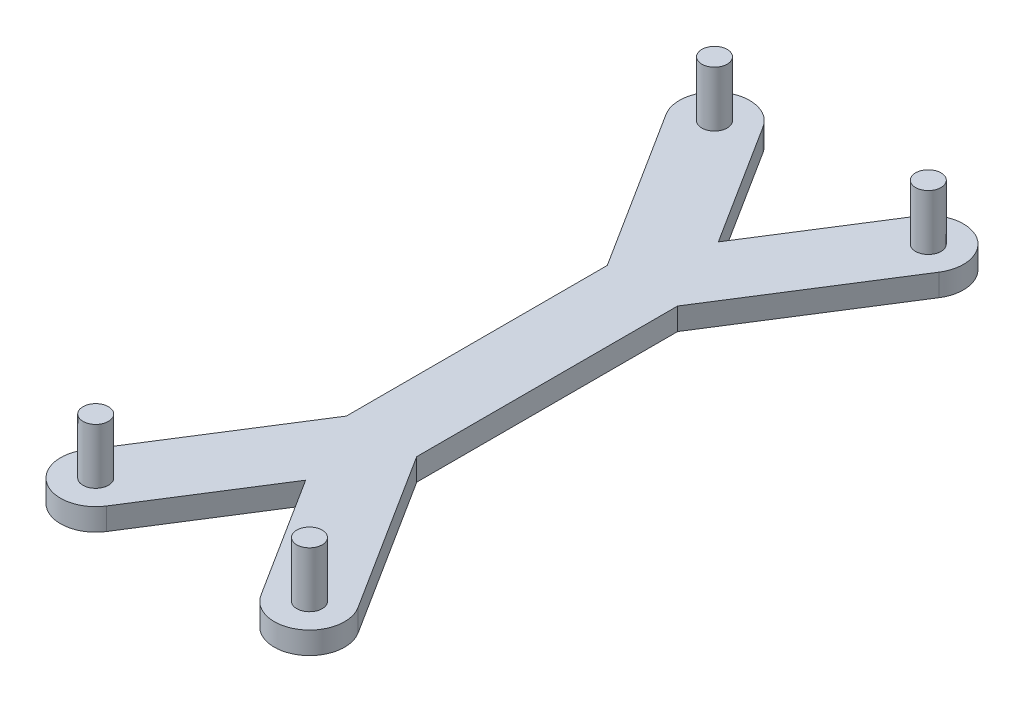
from build123d import *

# Parameters (mm, degrees)
SKETCH1_R             = 1.15
BOSS_EXTRUDE1_DEPTH   = 5
BOSS_EXTRUDE1_2_DEPTH = 5
BOSS_EXTRUDE1_3_DEPTH = 5
BOSS_EXTRUDE1_4_DEPTH = 5
BOSS_EXTRUDE2_START   = -2
SKETCH1_3_R           = 1.15
BOSS_EXTRUDE2_DEPTH   = 2


with BuildPart() as part:
    # Sketch1 → Boss-Extrude1 (new body)
    with BuildSketch(Plane(origin=(0, 0, 0), x_dir=(1, 0, 0), z_dir=(0, 1, 0))):
        with Locations((-9.652, 27.94)):
            Circle(SKETCH1_R)
    extrude(amount=BOSS_EXTRUDE1_DEPTH)


with BuildPart() as body_2:
    # Sketch1 → Boss-Extrude1 2 (new body)
    with BuildSketch(Plane(origin=(0, 0, 0), x_dir=(1, 0, 0), z_dir=(0, 1, 0))):
        with Locations((9.652, 27.94)):
            Circle(SKETCH1_R)
    extrude(amount=BOSS_EXTRUDE1_2_DEPTH)


with BuildPart() as body_3:
    # Sketch1 → Boss-Extrude1 3 (new body)
    with BuildSketch(Plane(origin=(0, 0, 0), x_dir=(1, 0, 0), z_dir=(0, 1, 0))):
        with Locations((-9.652, -27.94)):
            Circle(SKETCH1_R)
    extrude(amount=BOSS_EXTRUDE1_3_DEPTH)


with BuildPart() as body_4:
    # Sketch1 → Boss-Extrude1 4 (new body)
    with BuildSketch(Plane(origin=(0, 0, 0), x_dir=(1, 0, 0), z_dir=(0, 1, 0))):
        with Locations((9.652, -27.94)):
            Circle(SKETCH1_R)
    extrude(amount=BOSS_EXTRUDE1_4_DEPTH)


with BuildPart() as body_5:
    # Sketch1<3> → Boss-Extrude2 (new body)
    with BuildSketch(Plane(origin=(0, 0, 0), x_dir=(1, 0, 0), z_dir=(0, 1, 0)).offset(BOSS_EXTRUDE2_START)):
        with BuildLine():
            ThreePointArc((-6.969699435, 29.638790358), (-11.350790358, 30.622300565), (-12.334300565, 26.241209642))
            Line((-12.334300565, 26.241209642), (-3.175, 11.779156119))
            Line((-3.175, 11.779156119), (-3.175, -11.779156119))
            Line((-3.175, -11.779156119), (-12.334300565, -26.241209642))
            ThreePointArc((-12.334300565, -26.241209642), (-11.350790358, -30.622300565), (-6.969699435, -29.638790358))
            Line((-6.969699435, -29.638790358), (0, -18.634001776))
            Line((0, -18.634001776), (6.969699435, -29.638790358))
            ThreePointArc((6.969699435, -29.638790358), (11.350790358, -30.622300565), (12.334300565, -26.241209642))
            Line((12.334300565, -26.241209642), (3.175, -11.779156119))
            Line((3.175, -11.779156119), (3.175, 11.779156119))
            Line((3.175, 11.779156119), (12.334300565, 26.241209642))
            ThreePointArc((12.334300565, 26.241209642), (11.350790358, 30.622300565), (6.969699435, 29.638790358))
            Line((6.969699435, 29.638790358), (0, 18.634001776))
            Line((0, 18.634001776), (-6.969699435, 29.638790358))
        make_face()
        with Locations((-9.652, 27.94)):
            Circle(SKETCH1_3_R, mode=Mode.SUBTRACT)
        with Locations((9.652, 27.94)):
            Circle(SKETCH1_3_R, mode=Mode.SUBTRACT)
        with Locations((-9.652, -27.94)):
            Circle(SKETCH1_3_R, mode=Mode.SUBTRACT)
        with Locations((9.652, -27.94)):
            Circle(SKETCH1_3_R, mode=Mode.SUBTRACT)
    extrude(amount=BOSS_EXTRUDE2_DEPTH)


solid = Compound([part.part, body_2.part, body_3.part, body_4.part, body_5.part])
